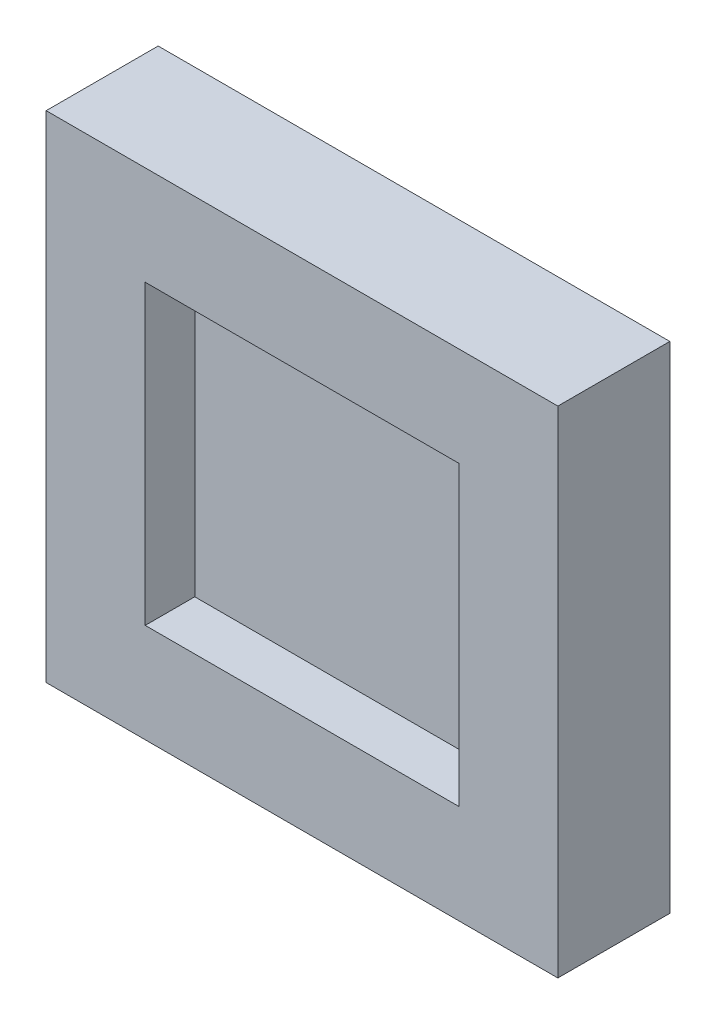
from build123d import *

# Parameters (mm, degrees)
RESSALTO_EXTRUS_O1_DEPTH      = 7.5
RESSALTO_EXTRUS_O1_DEPTH_BACK = 7.5
ESBO_O1_W                     = 364
ESBO_O1_H                     = 345
RESSALTO_EXTRUS_O2_DEPTH      = 65
RESSALTO_EXTRUS_O2_DEPTH_BACK = 65
ESBO_O2_W                     = 594
ESBO_O2_H                     = 575
ESBO_O2_W_2                   = 364
ESBO_O2_H_2                   = 345


with BuildPart() as part:
    # Esboço1 → Ressalto-extrusão1 (new, two sides: drawn at the far end of the back side and taken through both)
    with BuildSketch(Plane.XY.offset(-RESSALTO_EXTRUS_O1_DEPTH_BACK)):
        Rectangle(ESBO_O1_W, ESBO_O1_H)
    extrude(amount=RESSALTO_EXTRUS_O1_DEPTH + RESSALTO_EXTRUS_O1_DEPTH_BACK)


with BuildPart() as body_2:
    # Esboço2 → Ressalto-extrusão2 (new, two sides: drawn at the far end of the back side and taken through both)
    with BuildSketch(Plane.XY.offset(-RESSALTO_EXTRUS_O2_DEPTH_BACK)):
        Rectangle(ESBO_O2_W, ESBO_O2_H)
        Rectangle(ESBO_O2_W_2, ESBO_O2_H_2, mode=Mode.SUBTRACT)
    extrude(amount=RESSALTO_EXTRUS_O2_DEPTH + RESSALTO_EXTRUS_O2_DEPTH_BACK)


solid = Compound([part.part, body_2.part])
